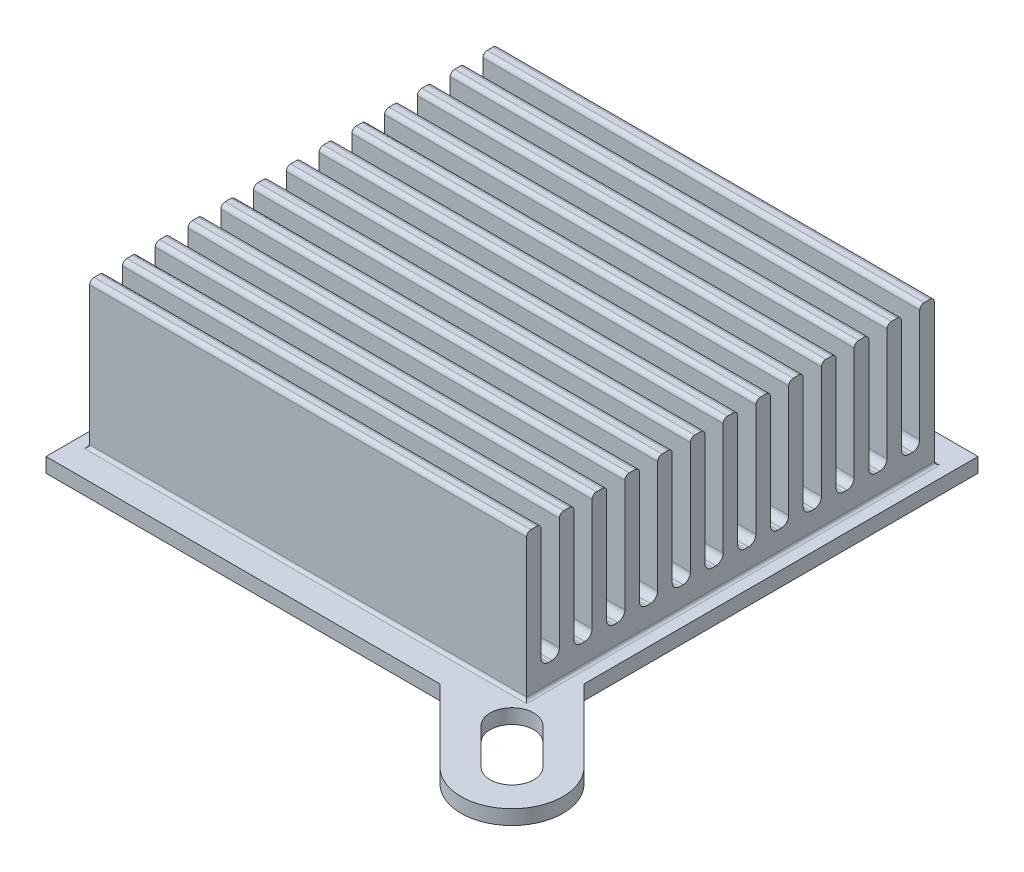
from build123d import *

# Parameters (mm, degrees)
DODANIE_WYCI_GNI_CIE2_DEPTH = 1
WYTNIJ_WYCI_GNI_CIE1_DEPTH  = 32.093249288
SZKIC4_W                    = 30
SZKIC4_H                    = 28
DODANIE_WYCI_GNI_CIE3_DEPTH = 1.5
SZKIC3_W                    = 30
SZKIC3_H                    = 1
DODANIE_WYCI_GNI_CIE4_DEPTH = 10
ZAOKR_GLENIE1_R             = 0.3
ZAOKR_GLENIE2_R             = 0.5
ZAOKR_GLENIE3_R             = 0.2


with BuildPart() as part:
    # Szkic1 → Dodanie-wyciągnięcie2 (new body)
    with BuildSketch(Plane(origin=(0, 0, 0), x_dir=(1, 0, 0), z_dir=(0, 1, 0))):
        with BuildLine():
            ThreePointArc((-14.974873734, 18.474873734), (-15.24129537, 19.814265747), (-16, 20.949747468))
            Line((-16, 20.949747468), (-20.949747468, 16))
            ThreePointArc((-20.949747468, 16), (-18.474873734, 14.974873734), (-16, 16))
            ThreePointArc((-16, 16), (-15.24129537, 17.135481721), (-14.974873734, 18.474873734))
        make_face()
        with BuildLine():
            Line((-20.949747468, 16), (-16, 20.949747468))
            ThreePointArc((-16, 20.949747468), (-20.949747468, 20.949747468), (-20.949747468, 16))
        make_face()
        with BuildLine():
            Line((-11.050252532, 16), (-16, 20.949747468))
            ThreePointArc((-16, 20.949747468), (-15.24129537, 19.814265747), (-14.974873734, 18.474873734))
            ThreePointArc((-14.974873734, 18.474873734), (-15.24129537, 17.135481721), (-16, 16))
            Line((-16, 16), (-11.050252532, 16))
        make_face()
        Polygon((16, -11.050252532), (-11.050252532, 16), (-16, 16), (-16, 11.050252532), (11.050252532, -16), (16, -16), align=None)
        with BuildLine():
            ThreePointArc((-16, 16), (-18.474873734, 14.974873734), (-20.949747468, 16))
            Line((-20.949747468, 16), (-16, 11.050252532))
            Line((-16, 11.050252532), (-16, 16))
        make_face()
        Polygon((11.050252532, -16), (-16, 11.050252532), (-16, -16), align=None)
        Polygon((16, 16), (-11.050252532, 16), (16, -11.050252532), align=None)
        with BuildLine():
            Line((20.949747468, -16), (16, -11.050252532))
            Line((16, -11.050252532), (16, -16))
            ThreePointArc((16, -16), (18.474873734, -14.974873734), (20.949747468, -16))
        make_face()
        with BuildLine():
            ThreePointArc((21.974873734, -18.474873734), (21.708452098, -17.135481721), (20.949747468, -16))
            Line((20.949747468, -16), (16, -20.949747468))
            ThreePointArc((16, -20.949747468), (19.814265747, -21.708452098), (21.974873734, -18.474873734))
        make_face()
        with BuildLine():
            Line((16, -20.949747468), (20.949747468, -16))
            ThreePointArc((20.949747468, -16), (18.474873734, -14.974873734), (16, -16))
            ThreePointArc((16, -16), (14.974873734, -18.474873734), (16, -20.949747468))
        make_face()
        with BuildLine():
            ThreePointArc((16, -20.949747468), (14.974873734, -18.474873734), (16, -16))
            Line((16, -16), (11.050252532, -16))
            Line((11.050252532, -16), (16, -20.949747468))
        make_face()
    extrude(amount=DODANIE_WYCI_GNI_CIE2_DEPTH)

    # Szkic2 → Wytnij-wyciągnięcie1 (cut, through all)
    with BuildSketch(Plane(origin=(0, 1, 0), x_dir=(1, 0, 0), z_dir=(0, 1, 0))):
        with BuildLine():
            Line((-17.414213562, 19.535533906), (-14.939339828, 17.060660172))
            ThreePointArc((-14.939339828, 17.060660172), (-14.939339828, 14.939339828), (-17.060660172, 14.939339828))
            Line((-17.060660172, 14.939339828), (-19.535533906, 17.414213562))
            ThreePointArc((-19.535533906, 17.414213562), (-19.535533906, 19.535533906), (-17.414213562, 19.535533906))
        make_face()
        with BuildLine():
            Line((19.535533906, -17.414213562), (17.060660172, -14.939339828))
            ThreePointArc((17.060660172, -14.939339828), (14.939339828, -14.939339828), (14.939339828, -17.060660172))
            Line((14.939339828, -17.060660172), (17.414213562, -19.535533906))
            ThreePointArc((17.414213562, -19.535533906), (19.535533906, -19.535533906), (19.535533906, -17.414213562))
        make_face()
    extrude(amount=-WYTNIJ_WYCI_GNI_CIE1_DEPTH, mode=Mode.SUBTRACT)

    # Szkic4 → Dodanie-wyciągnięcie3 (add)
    with BuildSketch(Plane(origin=(0, 1, 0), x_dir=(1, 0, 0), z_dir=(0, 1, 0))):
        Rectangle(SZKIC4_W, SZKIC4_H)
    extrude(amount=DODANIE_WYCI_GNI_CIE3_DEPTH)

    # Szkic3 → Dodanie-wyciągnięcie4 (add)
    with BuildSketch(Plane(origin=(0, 1, 0), x_dir=(1, 0, 0), z_dir=(0, 1, 0))):
        with Locations((0, 13.5)):
            Rectangle(SZKIC3_W, SZKIC3_H)
        with Locations((0, 4.5)):
            Rectangle(SZKIC3_W, SZKIC3_H)
        with Locations((0, -4.5)):
            Rectangle(SZKIC3_W, SZKIC3_H)
        with Locations((0, -11.25)):
            Rectangle(SZKIC3_W, SZKIC3_H)
        with Locations((0, -13.5)):
            Rectangle(SZKIC3_W, SZKIC3_H)
        with Locations((0, 11.25)):
            Rectangle(SZKIC3_W, SZKIC3_H)
        with Locations((0, 9)):
            Rectangle(SZKIC3_W, SZKIC3_H)
        with Locations((0, 6.75)):
            Rectangle(SZKIC3_W, SZKIC3_H)
        with Locations((0, 2.25)):
            Rectangle(SZKIC3_W, SZKIC3_H)
        Rectangle(SZKIC3_W, SZKIC3_H)
        with Locations((0, -2.25)):
            Rectangle(SZKIC3_W, SZKIC3_H)
        with Locations((0, -6.75)):
            Rectangle(SZKIC3_W, SZKIC3_H)
        with Locations((0, -9)):
            Rectangle(SZKIC3_W, SZKIC3_H)
    extrude(amount=DODANIE_WYCI_GNI_CIE4_DEPTH)

    # Zaokrąglenie1
    zaokr_glenie1_edges = [part.edges().sort_by_distance(p)[0] for p in [
        (0, 11, -5),
        (0, 11, -4),
        (0, 11, 4),
        (0, 11, 5),
        (0, 11, 10.75),
        (0, 11, 11.75),
        (0, 11, 13),
        (0, 11, 14),
        (0, 11, -11.75),
        (0, 11, -10.75),
        (0, 11, -9.5),
        (0, 11, -8.5),
        (0, 11, -7.25),
        (0, 11, -6.25),
        (0, 11, -2.75),
        (0, 11, -1.75),
        (0, 11, -0.5),
        (0, 11, 0.5),
        (0, 11, 1.75),
        (0, 11, 2.75),
        (0, 11, 6.25),
        (0, 11, 7.25),
        (0, 11, 8.5),
        (0, 11, 9.5),
        (0, 11, -14),
        (0, 11, -13),
    ]]
    fillet(zaokr_glenie1_edges, radius=ZAOKR_GLENIE1_R)

    # Zaokrąglenie2
    zaokr_glenie2_edges = [part.edges().sort_by_distance(p)[0] for p in [
        (0, 2.5, -4),
        (0, 2.5, -5),
        (0, 2.5, 5),
        (0, 2.5, 4),
        (0, 2.5, 11.75),
        (0, 2.5, 10.75),
        (0, 2.5, 13),
        (0, 2.5, -10.75),
        (0, 2.5, -11.75),
        (0, 2.5, -8.5),
        (0, 2.5, -9.5),
        (0, 2.5, -6.25),
        (0, 2.5, -7.25),
        (0, 2.5, -1.75),
        (0, 2.5, -2.75),
        (0, 2.5, 0.5),
        (0, 2.5, -0.5),
        (0, 2.5, 2.75),
        (0, 2.5, 1.75),
        (0, 2.5, 7.25),
        (0, 2.5, 6.25),
        (0, 2.5, 9.5),
        (0, 2.5, 8.5),
        (0, 2.5, -13),
    ]]
    fillet(zaokr_glenie2_edges, radius=ZAOKR_GLENIE2_R)

    # Zaokrąglenie3
    zaokr_glenie3_edges = [part.edges().sort_by_distance(p)[0] for p in [
        (-15, 1, 0),
        (0, 1, 14),
        (15, 1, 0),
        (0, 1, -14),
    ]]
    fillet(zaokr_glenie3_edges, radius=ZAOKR_GLENIE3_R)


solid = part.part
